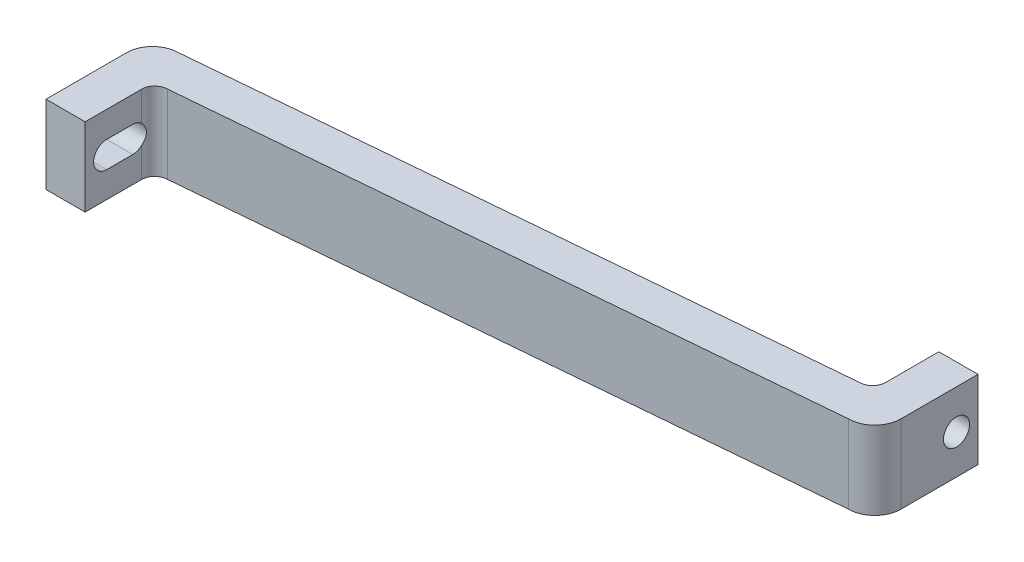
from build123d import *

# Parameters (mm, degrees)
BOSS_EXTRUDE1_DEPTH = 6
SKETCH3_R           = 1
CUT_EXTRUDE1_DEPTH  = 59


with BuildPart() as part:
    # Sketch1 → Boss-Extrude1 (new body)
    with BuildSketch(Plane(origin=(0, 0, 0), x_dir=(1, 0, 0), z_dir=(0, 1, 0))):
        with BuildLine():
            Line((0, 6.17), (0, 0))
            Line((0, 0), (3, 0))
            Line((3, 0), (3, 4.33))
            ThreePointArc((3, 4.33), (3.292893219, 5.037106781), (4, 5.33))
            Line((4, 5.33), (52, 9.54))
            ThreePointArc((52, 9.54), (53.414213562, 10.125786438), (54, 11.54))
            Line((54, 11.54), (54, 17.46))
            Line((54, 17.46), (51, 17.46))
            Line((51, 17.46), (51, 13.38))
            ThreePointArc((51, 13.38), (50.707106781, 12.672893219), (50, 12.38))
            Line((50, 12.38), (2, 8.17))
            ThreePointArc((2, 8.17), (0.585786438, 7.584213562), (0, 6.17))
        make_face()
    extrude(amount=BOSS_EXTRUDE1_DEPTH)

    # Sketch3 → Cut-Extrude1 (cut)
    with BuildSketch(Plane(origin=(0, 0, 0), x_dir=(0, 0, -1), z_dir=(1, 0, 0))):
        with Locations(Location((15.81, 3, 0), (0, 0, 180))):
            Circle(SKETCH3_R)
        with BuildLine():
            Line((1.65, 4), (3.65, 4))
            ThreePointArc((3.65, 4), (4.65, 3), (3.65, 2))
            Line((3.65, 2), (1.65, 2))
            ThreePointArc((1.65, 2), (0.65, 3), (1.65, 4))
        make_face()
    extrude(amount=CUT_EXTRUDE1_DEPTH, mode=Mode.SUBTRACT)


solid = part.part
